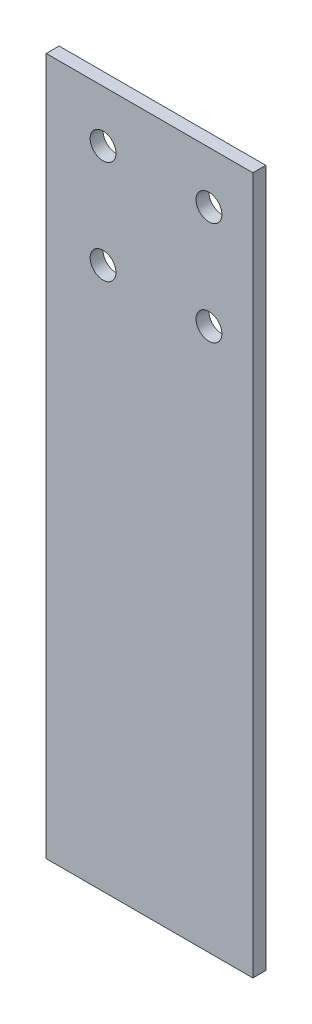
from build123d import *

# Parameters (mm, degrees)
SKETCH1_W           = 50.8
SKETCH1_H           = 171.45
BOSS_EXTRUDE2_DEPTH = 3.175
SKETCH2_R           = 3.175
CUT_EXTRUDE1_DEPTH  = 179.84580824


with BuildPart() as part:
    # Sketch1 → Boss-Extrude2 (new body)
    with BuildSketch(Plane.XY):
        with Locations((-25.4, 85.725)):
            Rectangle(SKETCH1_W, SKETCH1_H)
    extrude(amount=-BOSS_EXTRUDE2_DEPTH)

    # Sketch2 → Cut-Extrude1 (cut, through all)
    with BuildSketch(Plane.XY):
        with Locations((-10.795, 158.75)):
            Circle(SKETCH2_R)
        with Locations((-36.83, 158.75)):
            Circle(SKETCH2_R)
        with Locations((-10.795, 133.35)):
            Circle(SKETCH2_R)
        with Locations((-36.83, 133.35)):
            Circle(SKETCH2_R)
    extrude(amount=-CUT_EXTRUDE1_DEPTH, mode=Mode.SUBTRACT)


solid = part.part
